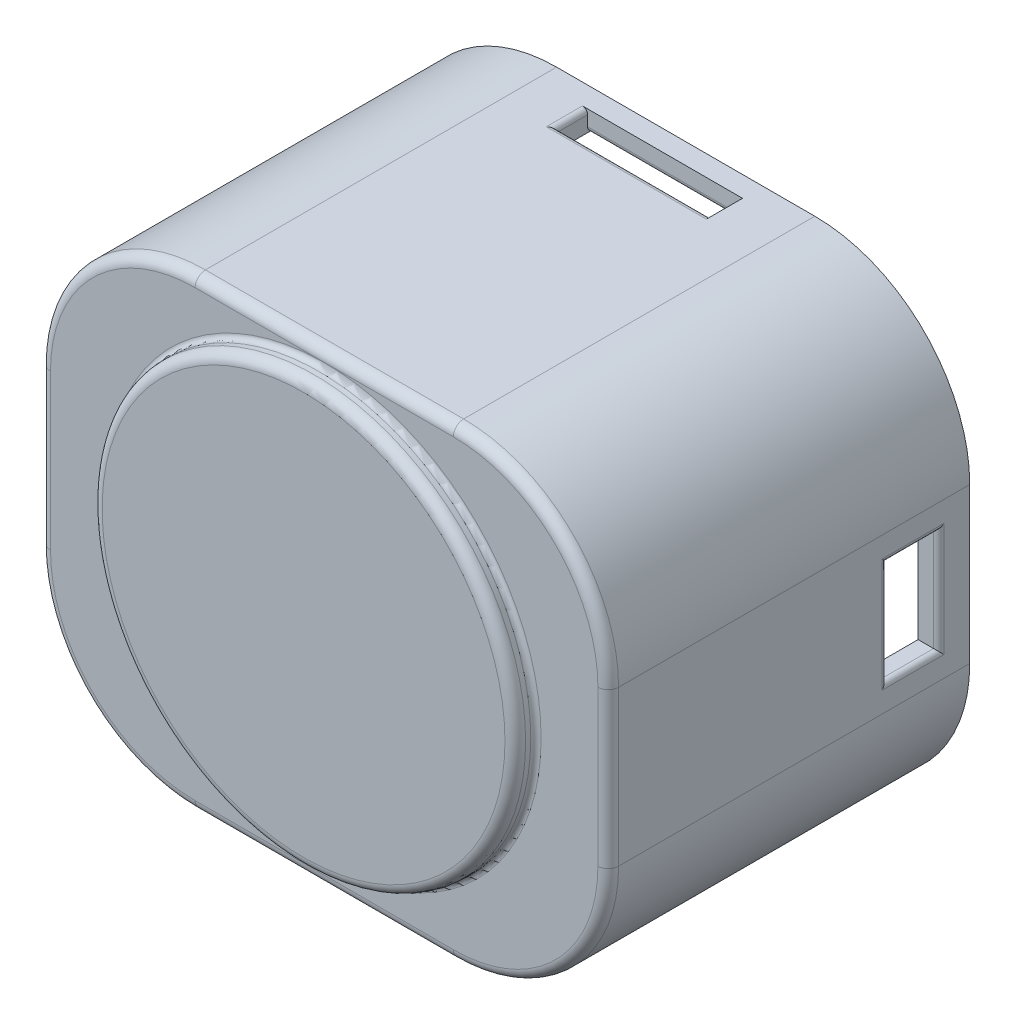
from build123d import *

# Parameters (mm, degrees)
SKETCH_1_W          = 55
SKETCH_1_H          = 45
EXTRUDE_1_DEPTH     = 35
SKETCH_4_R          = 20.5
EXTRUDE_3_DEPTH     = 2
FILLET_2_R          = 15
FILLET_3_R          = 15
FILLET_4_R          = 1
SHELL_1_T           = -2
EXTRUDE_START       = 5
SKETCH_7_R          = 21.5
SKETCH_7_R_2        = 20.5
EXTRUDE_4_DEPTH     = 5
FILLET_5_R          = 1
FILLET_6_R          = 0.5
CUT_EXTRUDE_1_REACH = 73.818
SKETCH_8_W          = 5
SKETCH_8_H          = 10
CUT_EXTRUDE_2_REACH = 68.168
SKETCH_14_W         = 15
SKETCH_14_H         = 3
CUT_EXTRUDE_3_REACH = 68.168
SKETCH_17_W         = 15
SKETCH_17_H         = 3
FILLET_9_R          = 0.5


with BuildPart() as part:
    # 스케치1 → 보스-돌출1 (new body)
    with BuildSketch(Plane.XY):
        with Locations((3.872936318, -5.136103152)):
            Rectangle(SKETCH_1_W, SKETCH_1_H)
    extrude(amount=EXTRUDE_1_DEPTH)

    # 스케치4 → 보스-돌출3 (add)
    with BuildSketch(Plane(origin=(-2.164184789, -3.486971785, 35), x_dir=(1, 0, 0), z_dir=(0, 0, 1))):
        with Locations((6.037121107, -1.171687144)):
            Circle(SKETCH_4_R)
    extrude(amount=EXTRUDE_3_DEPTH)

    # 필렛2
    fillet_2_edges = [part.edges().sort_by_distance(p)[0] for p in [
        (31.372936318, 17.363896848, 17.5),
    ]]
    fillet(fillet_2_edges, radius=FILLET_2_R)

    # 필렛3
    fillet_3_edges = [part.edges().sort_by_distance(p)[0] for p in [
        (-23.627063682, 17.363896848, 17.5),
        (31.372936318, -27.636103152, 17.5),
        (-23.627063682, -27.636103152, 17.5),
    ]]
    fillet(fillet_3_edges, radius=FILLET_3_R)

    # 필렛4
    fillet_4_edges = [part.edges().sort_by_distance(p)[0] for p in [
        (3.872936318, 17.363896848, 35),
        (26.979538036, 12.970498566, 35),
        (3.872936318, -27.636103152, 35),
        (-23.627063682, -5.136103152, 35),
        (31.372936318, -5.136103152, 35),
        (-19.2336654, 12.970498566, 35),
        (26.979538036, -23.24270487, 35),
        (-19.2336654, -23.24270487, 35),
    ]]
    fillet(fillet_4_edges, radius=FILLET_4_R)

    # 쉘1
    shell_1_openings = [part.faces().sort_by_distance(p)[0] for p in [
        (3.872936318, -5.136103152, 0),
    ]]
    offset(amount=SHELL_1_T, openings=shell_1_openings, kind=Kind.INTERSECTION)

    # 스케치7 → 보스-돌출4 (add)
    with BuildSketch(Plane(origin=(0, 0, 33), x_dir=(-1, 0, 0), z_dir=(0, 0, -1)).offset(EXTRUDE_START)):
        with Locations((-3.872936318, -4.658658928)):
            Circle(SKETCH_7_R)
        with Locations(Location((-3.872936318, -4.658658928, 0), (0, 0, 180))):
            Circle(SKETCH_7_R_2, mode=Mode.SUBTRACT)
    extrude(amount=-EXTRUDE_4_DEPTH)

    # 필렛5
    fillet_5_edges = [part.edges().sort_by_distance(p)[0] for p in [
        (-16.627063682, -4.658658928, 37),
    ]]
    fillet(fillet_5_edges, radius=FILLET_5_R)

    # 필렛6
    fillet_6_edges = [part.edges().sort_by_distance(p)[0] for p in [
        (-16.627063682, -4.658658928, 35),
    ]]
    fillet(fillet_6_edges, radius=FILLET_6_R)

    # 스케치8 → 컷-돌출1 (cut, up to next)
    with BuildSketch(Plane(origin=(31.372936318, 0, 0), x_dir=(0, 0, -1), z_dir=(1, 0, 0)), mode=Mode.PRIVATE) as cut_extrude_1_sk1:
        with Locations((-5.5, -5.136103152)):
            Rectangle(SKETCH_8_W, SKETCH_8_H)
    cut_extrude_1_tool1 = extrude(cut_extrude_1_sk1.sketch, amount=-CUT_EXTRUDE_1_REACH, mode=Mode.PRIVATE) & part.part
    add(cut_extrude_1_tool1.solids().sort_by_distance((31.372936, -5.136103, 5.5))[0], mode=Mode.SUBTRACT)

    # 스케치14 → 컷-돌출2 (cut, up to next)
    with BuildSketch(Plane(origin=(0, 17.363896848, 0), x_dir=(1, 0, 0), z_dir=(0, 1, 0)), mode=Mode.PRIVATE) as cut_extrude_2_sk1:
        with Locations((3.872936318, -3.5)):
            Rectangle(SKETCH_14_W, SKETCH_14_H)
    cut_extrude_2_tool1 = extrude(cut_extrude_2_sk1.sketch, amount=-CUT_EXTRUDE_2_REACH, mode=Mode.PRIVATE) & part.part
    add(cut_extrude_2_tool1.solids().sort_by_distance((3.872936, 17.363897, 3.5))[0], mode=Mode.SUBTRACT)

    # 스케치17 → 컷-돌출3 (cut, up to next)
    with BuildSketch(Plane.XZ.offset(27.636103152), mode=Mode.PRIVATE) as cut_extrude_3_sk1:
        with Locations((3.872936318, 3.5)):
            Rectangle(SKETCH_17_W, SKETCH_17_H)
    cut_extrude_3_tool1 = extrude(cut_extrude_3_sk1.sketch, amount=-CUT_EXTRUDE_3_REACH, mode=Mode.PRIVATE) & part.part
    add(cut_extrude_3_tool1.solids().sort_by_distance((3.872936, -27.636103, 3.5))[0], mode=Mode.SUBTRACT)

    # 필렛9
    fillet_9_edges = [part.edges().sort_by_distance(p)[0] for p in [
        (31.372936318, -5.136103152, 3),
        (31.372936318, -0.136103152, 5.5),
        (31.372936318, -5.136103152, 8),
        (31.372936318, -10.136103152, 5.5),
        (11.372936318, 15.363896848, 3.5),
        (3.872936318, 15.363896848, 2),
        (-3.627063682, 17.363896848, 3.5),
        (3.872936318, 17.363896848, 5),
        (3.872936318, -27.636103152, 5),
        (11.372936318, -27.636103152, 3.5),
        (3.872936318, -27.636103152, 2),
        (-3.627063682, -27.636103152, 3.5),
    ]]
    fillet(fillet_9_edges, radius=FILLET_9_R)


solid = part.part
